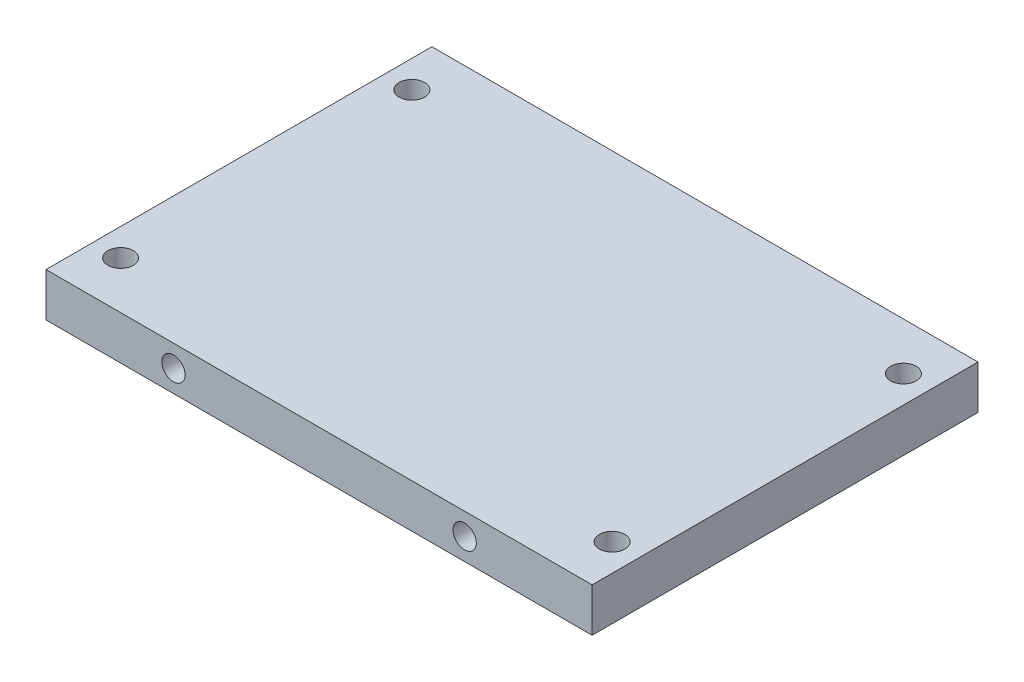
from build123d import *

# Parameters (mm, degrees)
SKETCH1_W           = 75
SKETCH1_H           = 53
SKETCH1_R           = 1.75
BOSS_EXTRUDE8_DEPTH = 6
SKETCH6_R           = 1.6
CUT_EXTRUDE2_DEPTH  = 5


with BuildPart() as part:
    # Sketch1 → Boss-Extrude8 (new body)
    with BuildSketch(Plane(origin=(0, 0, 0), x_dir=(1, 0, 0), z_dir=(0, 1, 0))):
        with Locations((37.5, -26.5)):
            Rectangle(SKETCH1_W, SKETCH1_H)
        with Locations(Location((71.25, -6.5, 0), (0, 0, 270))):
            Circle(SKETCH1_R, mode=Mode.SUBTRACT)
        with Locations(Location((3.75, -6.5, 0), (0, 0, 270))):
            Circle(SKETCH1_R, mode=Mode.SUBTRACT)
        with Locations(Location((71.25, -46.5, 0), (0, 0, 270))):
            Circle(SKETCH1_R, mode=Mode.SUBTRACT)
        with Locations(Location((3.75, -46.5, 0), (0, 0, 270))):
            Circle(SKETCH1_R, mode=Mode.SUBTRACT)
    extrude(amount=BOSS_EXTRUDE8_DEPTH)

    # Sketch6 → Cut-Extrude2 (cut)
    with BuildSketch(Plane(origin=(0, 0, 0), x_dir=(-1, 0, 0), z_dir=(0, 0, -1))):
        with Locations((-57.5, 3)):
            Circle(SKETCH6_R)
        with Locations((-17.5, 3)):
            Circle(SKETCH6_R)
    cut_extrude2 = extrude(amount=-CUT_EXTRUDE2_DEPTH, mode=Mode.SUBTRACT)

    # Mirror1: Cut-Extrude2 across plane
    add(cut_extrude2.mirror(Plane.XY.offset(26.5)), mode=Mode.SUBTRACT)


solid = part.part
